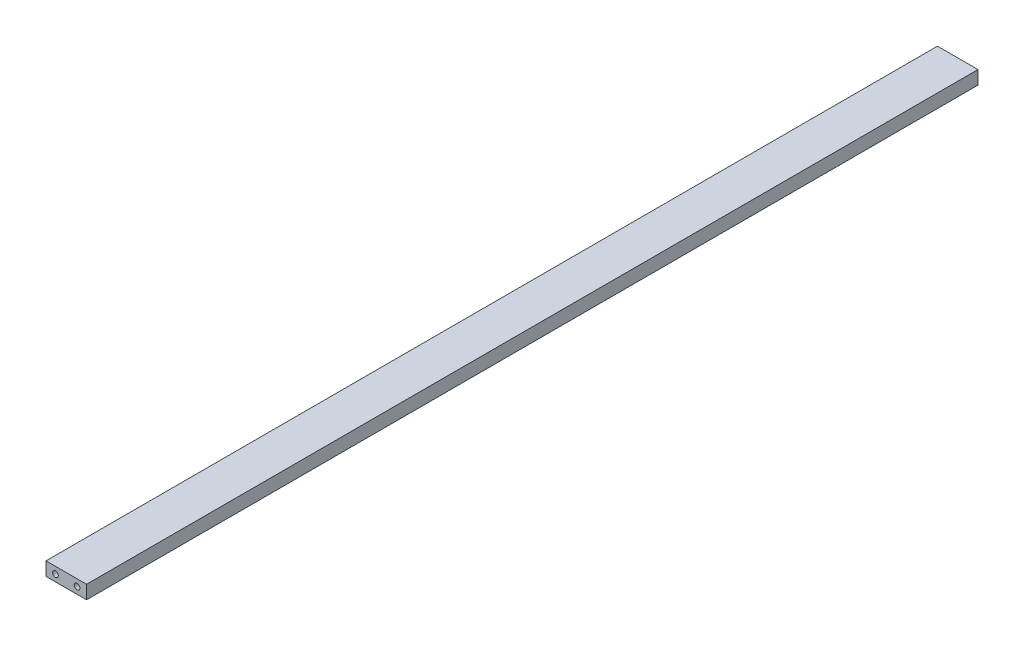
from build123d import *

# Parameters (mm, degrees)
SKETCH1_W             = 30
SKETCH1_H             = 10
BOSS_EXTRUDE1_DEPTH   = 660
M5_TAPPED_HOLE1_D     = 4.2
M5_TAPPED_HOLE1_DEPTH = 17.4
M5_TAPPED_HOLE1_TIP   = 1.2618073
M5_TAPPED_HOLE2_D     = 4.2
M5_TAPPED_HOLE2_DEPTH = 17.4
M5_TAPPED_HOLE2_TIP   = 1.2618073
M5_TAPPED_HOLE3_D     = 4.2
M5_TAPPED_HOLE3_DEPTH = 17.4
M5_TAPPED_HOLE3_TIP   = 1.2618073


with BuildPart() as part:
    # Sketch1 → Boss-Extrude1 (new body)
    with BuildSketch(Plane.XY):
        Rectangle(SKETCH1_W, SKETCH1_H)
    extrude(amount=BOSS_EXTRUDE1_DEPTH)

    # M5 Tapped Hole1
    with Locations(Plane(origin=(-8, 0, 0), x_dir=(-1, 0, 0), z_dir=(0, 0, -1))):
        with Locations((0, 0), (-16, 0)):
            Hole(M5_TAPPED_HOLE1_D / 2, depth=M5_TAPPED_HOLE1_DEPTH)
            with Locations((0, 0, -(M5_TAPPED_HOLE1_DEPTH + M5_TAPPED_HOLE1_TIP / 2))):  # 118° drill point
                Cone(0, M5_TAPPED_HOLE1_D / 2, M5_TAPPED_HOLE1_TIP, mode=Mode.SUBTRACT)

    # M5 Tapped Hole2
    with Locations(Plane(origin=(-8, 0, 0), x_dir=(-1, 0, 0), z_dir=(0, 0, -1))):
        with Locations((0, 0), (-16, 0)):
            Hole(M5_TAPPED_HOLE2_D / 2, depth=M5_TAPPED_HOLE2_DEPTH)
            with Locations((0, 0, -(M5_TAPPED_HOLE2_DEPTH + M5_TAPPED_HOLE2_TIP / 2))):  # 118° drill point
                Cone(0, M5_TAPPED_HOLE2_D / 2, M5_TAPPED_HOLE2_TIP, mode=Mode.SUBTRACT)

    # M5 Tapped Hole3
    with Locations(Plane(origin=(-8, 0, 660), x_dir=(1, 0, 0), z_dir=(0, 0, 1))):
        with Locations((0, 0), (16, 0)):
            Hole(M5_TAPPED_HOLE3_D / 2, depth=M5_TAPPED_HOLE3_DEPTH)
            with Locations((0, 0, -(M5_TAPPED_HOLE3_DEPTH + M5_TAPPED_HOLE3_TIP / 2))):  # 118° drill point
                Cone(0, M5_TAPPED_HOLE3_D / 2, M5_TAPPED_HOLE3_TIP, mode=Mode.SUBTRACT)


solid = part.part
